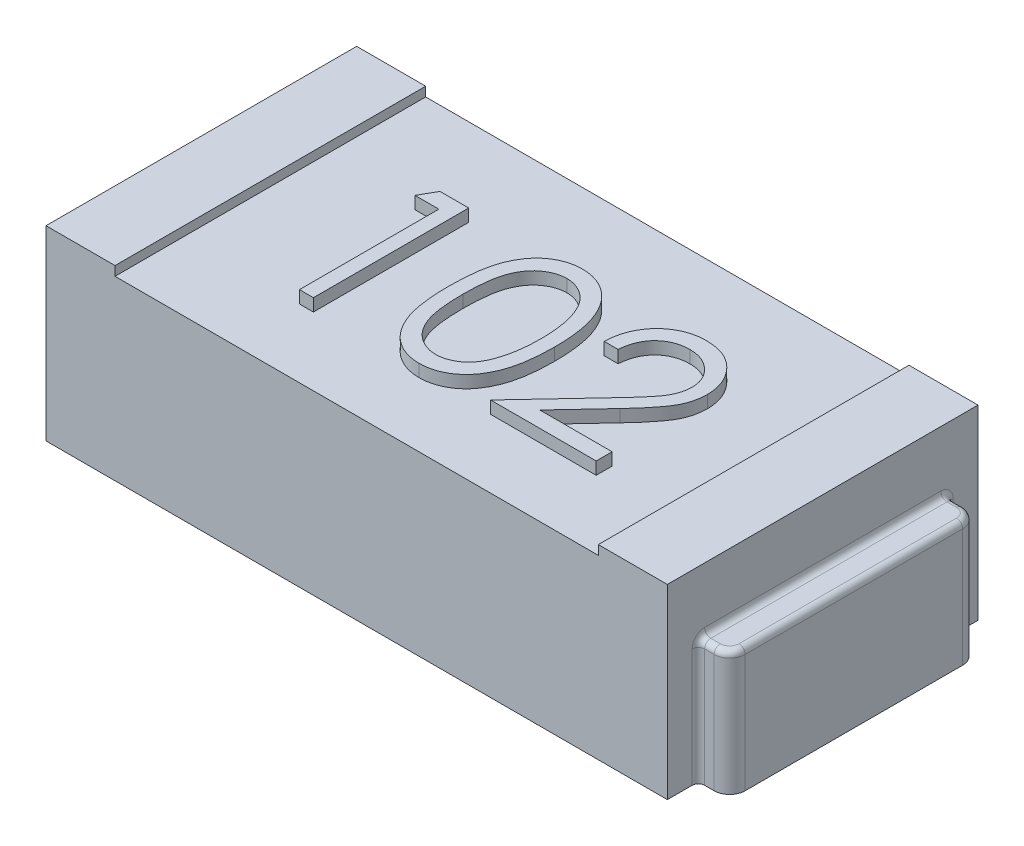
from build123d import *

# Parameters (mm, degrees)
ESQUISSE1_W             = 2
ESQUISSE1_H             = 1
BOSS_EXTRU_1_DEPTH      = 0.6
ESQUISSE2_W             = 1.555645222
ESQUISSE2_H             = 1
ENL_V_MAT_EXTRU_1_DEPTH = 0.03
BOSS_EXTRU_2_DEPTH      = 0.4
CONG_1_R                = 0.02
CONG_1_OF_SYM_TRIE2_R   = 0.02
BOSS_EXTRU_3_DEPTH      = 0.04


with BuildPart() as part:
    # Esquisse1 → Boss.-Extru.1 (new body)
    with BuildSketch(Plane(origin=(0, 0, 0), x_dir=(1, 0, 0), z_dir=(0, 1, 0))):
        Rectangle(ESQUISSE1_W, ESQUISSE1_H)
    extrude(amount=BOSS_EXTRU_1_DEPTH)

    # Esquisse2 → Enlèv. mat.-Extru.1 (cut)
    with BuildSketch(Plane(origin=(0, 0.6, 0), x_dir=(1, 0, 0), z_dir=(0, 1, 0))):
        Rectangle(ESQUISSE2_W, ESQUISSE2_H)
    extrude(amount=-ENL_V_MAT_EXTRU_1_DEPTH, mode=Mode.SUBTRACT)

    # Esquisse3 → Boss.-Extru.2 (add)
    with BuildSketch(Plane(origin=(0, 0, 0), x_dir=(1, 0, 0), z_dir=(0, 1, 0))):
        with BuildLine():
            Line((1, 0.4), (1.050552667, 0.4))
            ThreePointArc((1.050552667, 0.4), (1.085908006, 0.385355339), (1.100552667, 0.35))
            Line((1.100552667, 0.35), (1.100552667, -0.35))
            ThreePointArc((1.100552667, -0.35), (1.085908006, -0.385355339), (1.050552667, -0.4))
            Line((1.050552667, -0.4), (1, -0.4))
            Line((1, -0.4), (1, 0.4))
        make_face()
    boss_extru_2 = extrude(amount=BOSS_EXTRU_2_DEPTH)

    # Congé1
    cong_1_edges = [part.edges().sort_by_distance(p)[0] for p in [
        (1, 0.2, -0.4),
        (1, 0.2, 0.4),
        (1, 0.4, 0),
        (1.025276334, 0.4, 0.4),
        (1.085908006, 0.4, 0.385355339),
        (1.100552667, 0.4, 0),
        (1.085908006, 0.4, -0.385355339),
        (1.025276334, 0.4, -0.4),
    ]]
    fillet(cong_1_edges, radius=CONG_1_R)

    # Symétrie2: Boss.-Extru.2 across plane
    add(boss_extru_2.mirror(Plane(origin=(0, 0, 0), x_dir=(0, 0, 1), z_dir=(1, 0, 0))))

    # Congé1 of Symétrie2
    cong_1_of_sym_trie2_edges = [part.edges().sort_by_distance(p)[0] for p in [
        (-1, 0.2, -0.4),
        (-1, 0.2, 0.4),
        (-1, 0.4, 0),
        (-1.025276334, 0.4, 0.4),
        (-1.085908006, 0.4, 0.385355339),
        (-1.100552667, 0.4, 0),
        (-1.085908006, 0.4, -0.385355339),
        (-1.025276334, 0.4, -0.4),
    ]]
    fillet(cong_1_of_sym_trie2_edges, radius=CONG_1_OF_SYM_TRIE2_R)

    # Esquisse4 → Boss.-Extru.3 (add)
    # profile 1 of 3: a face of its own
    with BuildSketch(Plane(origin=(0, 0.57, 0), x_dir=(1, 0, 0), z_dir=(0, 1, 0))):
        with BuildLine():
            Line((0.275641026, 0.065854324), (0.230769231, 0.065854324))
            add(Edge.make_bspline(
                [(0.230769231, 0.065854324), (0.231061681, 0.071807307), (0.231636046, 0.08349881), (0.234325802, 0.100545082), (0.238174498, 0.116838625), (0.243616135, 0.132248612), (0.250374174, 0.146911299), (0.258478464, 0.160768444), (0.268077586, 0.173767185), (0.278964262, 0.18578702), (0.290788353, 0.196813816), (0.303546344, 0.206335994), (0.316952777, 0.214381375), (0.330966977, 0.221107267), (0.345747057, 0.226155816), (0.361158894, 0.229901765), (0.377270199, 0.232155528), (0.388247345, 0.232397784), (0.393830128, 0.23252099)],
                knots=[0, 0, 0, 0, 1.10065271, 2.161652631, 3.183658789, 4.190468796, 5.17591951, 6.163126047, 7.15150782, 8.156236427, 9.156009102, 10.134482811, 11.092018607, 12.041330605, 13.001268258, 13.972401359, 14.968799086, 16, 16, 16, 16], degree=3))
            add(Edge.make_bspline(
                [(0.393830128, 0.23252099), (0.39931271, 0.232392639), (0.410085788, 0.232140434), (0.425808933, 0.229974573), (0.440777118, 0.226582346), (0.454961085, 0.221823), (0.468247665, 0.215425225), (0.480736672, 0.207739862), (0.492576787, 0.198851315), (0.503234899, 0.188386485), (0.513021768, 0.177214715), (0.521464947, 0.165287872), (0.528695399, 0.152969403), (0.53472221, 0.140165374), (0.539158802, 0.126755227), (0.542527117, 0.112934198), (0.544431033, 0.098559225), (0.544723237, 0.088829717), (0.544871795, 0.08388317)],
                knots=[0, 0, 0, 0, 1.111607364, 2.184268762, 3.212621178, 4.221274766, 5.211760367, 6.196651075, 7.1921475, 8.207485113, 9.220403448, 10.201281604, 11.166441695, 12.114753415, 13.065576456, 14.026450734, 14.996634279, 16, 16, 16, 16], degree=3))
            add(Edge.make_bspline(
                [(0.544871795, 0.08388317), (0.5446299, 0.076919193), (0.544150356, 0.063113449), (0.540048302, 0.042825611), (0.533641657, 0.023169408), (0.525927749, 0.007349794), (0.518145972, -0.005397848), (0.511133471, -0.015893378), (0.502924212, -0.027194159), (0.493398712, -0.03926235), (0.482754016, -0.052192479), (0.470893707, -0.065976736), (0.45773321, -0.080472703), (0.448496281, -0.090373503), (0.443709936, -0.09550385)],
                knots=[0, 0, 0, 0, 1.184426356, 2.348067706, 3.509069118, 4.696110526, 5.333549288, 6.050745305, 6.844228056, 7.710549037, 8.667450064, 9.695053472, 10.805634456, 12, 12, 12, 12], degree=3))
            Line((0.443709936, -0.09550385), (0.318609776, -0.229017471))
            Line((0.318609776, -0.229017471), (0.551282051, -0.229017471))
            Line((0.551282051, -0.229017471), (0.551282051, -0.280299523))
            Line((0.551282051, -0.280299523), (0.211538462, -0.280299523))
            Line((0.211538462, -0.280299523), (0.405448718, -0.073368433))
            add(Edge.make_bspline(
                [(0.405448718, -0.073368433), (0.410169845, -0.068440103), (0.419238163, -0.058973791), (0.432064245, -0.045153368), (0.443584101, -0.032332005), (0.4538723, -0.020533927), (0.462705658, -0.00958656), (0.470544548, 0.000155541), (0.476825347, 0.009120462), (0.483641832, 0.019511978), (0.490243829, 0.032199452), (0.495917023, 0.047704265), (0.499376287, 0.063665301), (0.499791263, 0.074451306), (0.5, 0.079876759)],
                knots=[0, 0, 0, 0, 1.329631726, 2.553950428, 3.673215718, 4.687767853, 5.603093632, 6.413772471, 7.123043292, 7.734684054, 8.834405432, 9.900288307, 10.943827018, 12, 12, 12, 12], degree=3))
            add(Edge.make_bspline(
                [(0.5, 0.079876759), (0.49990918, 0.083288388), (0.49973019, 0.090012052), (0.498150519, 0.099870018), (0.495763304, 0.109379277), (0.492342553, 0.11856908), (0.487827304, 0.12734703), (0.482331107, 0.135723813), (0.47598967, 0.143822236), (0.468653774, 0.151415565), (0.460594985, 0.158370023), (0.452081521, 0.164530606), (0.443074363, 0.169679051), (0.433611489, 0.17389955), (0.423719279, 0.177210319), (0.413378601, 0.179504402), (0.402618027, 0.180944757), (0.395270385, 0.181139638), (0.391526442, 0.181238939)],
                knots=[0, 0, 0, 0, 0.991446411, 1.95395049, 2.89581595, 3.838931463, 4.798493298, 5.75982156, 6.748411868, 7.785213223, 8.824556874, 9.840280684, 10.836137867, 11.835679398, 12.848801643, 13.863922112, 14.911575587, 16, 16, 16, 16], degree=3))
            add(Edge.make_bspline(
                [(0.391526442, 0.181238939), (0.387616323, 0.181136791), (0.379937495, 0.180936191), (0.368663348, 0.179532953), (0.357908237, 0.177112119), (0.347645108, 0.173801165), (0.337856595, 0.169592801), (0.328590303, 0.164351123), (0.319867034, 0.158096338), (0.311670387, 0.15100483), (0.30411839, 0.143109459), (0.297483122, 0.134308036), (0.291685406, 0.124761262), (0.286626944, 0.114494898), (0.282518988, 0.103415786), (0.279379967, 0.091563257), (0.276896132, 0.078988774), (0.276066343, 0.07030519), (0.275641026, 0.065854324)],
                knots=[0, 0, 0, 0, 1.031018746, 2.02475058, 2.990194455, 3.934040569, 4.864654155, 5.795059489, 6.735614925, 7.690564532, 8.649604399, 9.611025574, 10.590972636, 11.591080095, 12.624614302, 13.701020113, 14.821632451, 16, 16, 16, 16], degree=3))
        make_face()
    # profile 2 of 3: a face of its own
    with BuildSketch(Plane(origin=(0, 0.57, 0), x_dir=(1, 0, 0), z_dir=(0, 1, 0))):
        with BuildLine():
            add(Edge.make_bspline(
                [(-0.173076923, -0.030499843), (-0.173030063, -0.022485931), (-0.172939038, -0.00691879), (-0.171926406, 0.01576473), (-0.170244214, 0.037044772), (-0.167938875, 0.056922352), (-0.16513345, 0.075402605), (-0.16138838, 0.092436141), (-0.157129408, 0.108101799), (-0.152193345, 0.122450663), (-0.14662366, 0.13567605), (-0.140561623, 0.148022507), (-0.133766653, 0.159471354), (-0.126627094, 0.170205324), (-0.11885394, 0.180048709), (-0.110668399, 0.189140518), (-0.101750988, 0.197270626), (-0.092404844, 0.20467724), (-0.082545349, 0.211170022), (-0.07245354, 0.216888984), (-0.062059953, 0.22177468), (-0.051336213, 0.225616171), (-0.040378704, 0.228789149), (-0.029149123, 0.230958998), (-0.017628929, 0.232324271), (-0.009853009, 0.232454795), (-0.005909455, 0.23252099)],
                knots=[0, 0, 0, 0, 1.646270934, 3.197905019, 4.663502075, 6.030701355, 7.308322542, 8.50163776, 9.611534131, 10.641858119, 11.616356847, 12.558055219, 13.465016945, 14.349605745, 15.204443733, 16.039544428, 16.859896111, 17.680448484, 18.487036065, 19.28249412, 20.06191084, 20.843045899, 21.620316918, 22.403196591, 23.190181807, 24, 24, 24, 24], degree=3))
            add(Edge.make_bspline(
                [(-0.005909455, 0.23252099), (-0.001932958, 0.232451302), (0.005975043, 0.232312715), (0.017666525, 0.230980723), (0.029087908, 0.228770563), (0.0401905, 0.225638995), (0.051065498, 0.221753898), (0.061627842, 0.21688431), (0.071943139, 0.211215901), (0.081847466, 0.204555347), (0.091449554, 0.197129307), (0.100513548, 0.18873464), (0.109040275, 0.179456109), (0.117136747, 0.169392986), (0.124573261, 0.158352259), (0.13165518, 0.146525958), (0.137994042, 0.133707263), (0.144098996, 0.120110053), (0.149368565, 0.105358102), (0.154120886, 0.089534565), (0.157960739, 0.072452538), (0.161159206, 0.054201646), (0.163637048, 0.034714862), (0.165441712, 0.01403396), (0.16639501, -0.007854667), (0.166574538, -0.022820074), (0.166666667, -0.030499843)],
                knots=[0, 0, 0, 0, 0.810914788, 1.612654377, 2.396697861, 3.181598691, 3.963628158, 4.749916497, 5.551656086, 6.361998678, 7.18212741, 8.025565596, 8.878627764, 9.750805457, 10.657531673, 11.591944965, 12.560506719, 13.57287815, 14.630710178, 15.753379473, 16.941251878, 18.199788006, 19.531962791, 20.947069417, 22.433333509, 24, 24, 24, 24], degree=3))
            add(Edge.make_bspline(
                [(0.166666667, -0.030499843), (0.166573583, -0.038146116), (0.166392214, -0.053044566), (0.165452398, -0.074834705), (0.163601165, -0.095405854), (0.161285453, -0.114807349), (0.158078172, -0.132958437), (0.154134577, -0.14992193), (0.14975596, -0.165771083), (0.144350989, -0.180376056), (0.138435173, -0.193940588), (0.131998717, -0.206607324), (0.125103027, -0.218488222), (0.117590349, -0.229488186), (0.109582719, -0.239685137), (0.100908749, -0.248899083), (0.091812951, -0.257352037), (0.082182606, -0.264873698), (0.072123813, -0.271457241), (0.061843945, -0.277344934), (0.051160605, -0.282092462), (0.040315897, -0.286168896), (0.029154702, -0.289283247), (0.017690932, -0.291436655), (0.005982898, -0.292946919), (-0.001931611, -0.29306213), (-0.005909455, -0.293120035)],
                knots=[0, 0, 0, 0, 1.561518951, 3.042555995, 4.452378317, 5.7783523, 7.031515105, 8.214008947, 9.334062868, 10.386615937, 11.391082383, 12.354592575, 13.286541444, 14.194233754, 15.072674879, 15.931287219, 16.775624067, 17.606195743, 18.42308326, 19.229000347, 20.022332153, 20.807536673, 21.593273796, 22.3848459, 23.188221202, 24, 24, 24, 24], degree=3))
            add(Edge.make_bspline(
                [(-0.005909455, -0.293120035), (-0.0098529, -0.293053413), (-0.017628604, -0.292922047), (-0.029150379, -0.291562943), (-0.040333585, -0.289377871), (-0.051233407, -0.286318356), (-0.061905766, -0.282573379), (-0.072205236, -0.277694282), (-0.082246333, -0.272075129), (-0.09200227, -0.265675783), (-0.101289721, -0.258344114), (-0.110160951, -0.25023493), (-0.118393096, -0.241145871), (-0.12605511, -0.231220454), (-0.133337123, -0.22054999), (-0.140035605, -0.208988794), (-0.146231441, -0.196582707), (-0.151894797, -0.183251577), (-0.156916034, -0.168800873), (-0.161351421, -0.153065276), (-0.164853444, -0.135905899), (-0.167851009, -0.117460561), (-0.170268778, -0.09765), (-0.171919396, -0.07646346), (-0.172939583, -0.053914145), (-0.173030308, -0.038447034), (-0.173076923, -0.030499843)],
                knots=[0, 0, 0, 0, 0.810891512, 1.598919785, 2.382837074, 3.152667961, 3.926044502, 4.706494248, 5.493654104, 6.291793342, 7.103789334, 7.925228297, 8.761435821, 9.622817696, 10.50288917, 11.416980706, 12.369136599, 13.353924996, 14.394355917, 15.514179734, 16.714354668, 17.994756427, 19.357759367, 20.818452758, 22.365282078, 24, 24, 24, 24], degree=3))
        make_face()
        with BuildLine():
            add(Edge.make_bspline(
                [(-0.128205128, -0.030299523), (-0.128188064, -0.036977908), (-0.128154947, -0.049939343), (-0.127289775, -0.068774095), (-0.126111171, -0.086341285), (-0.124590985, -0.102663218), (-0.122333421, -0.117684649), (-0.11980388, -0.131508889), (-0.116725582, -0.14406278), (-0.113083436, -0.155432467), (-0.108934994, -0.165810906), (-0.104405585, -0.175468222), (-0.099539767, -0.184518499), (-0.094094174, -0.192880443), (-0.088163451, -0.200581323), (-0.081881557, -0.207757442), (-0.075014045, -0.214157011), (-0.06551351, -0.221832276), (-0.052971157, -0.229763581), (-0.037168234, -0.236670165), (-0.020929884, -0.241010516), (-0.009908277, -0.241562481), (-0.004407051, -0.241837984)],
                knots=[0, 0, 0, 0, 1.459021318, 2.831673884, 4.118529203, 5.306027144, 6.411944654, 7.436330062, 8.375795394, 9.233974572, 10.042671642, 10.816086306, 11.563610507, 12.285937304, 12.993564865, 13.685989202, 14.367179055, 15.041617293, 16.353048772, 17.594441528, 18.799311195, 20, 20, 20, 20], degree=3))
            add(Edge.make_bspline(
                [(-0.004407051, -0.241837984), (0.001129759, -0.24160973), (0.012191948, -0.241153692), (0.028353919, -0.236753873), (0.044043957, -0.230115367), (0.056339949, -0.222265723), (0.065694598, -0.214790248), (0.072397025, -0.208416726), (0.078548746, -0.201280174), (0.084383328, -0.193580275), (0.089734625, -0.18516992), (0.094600787, -0.176089552), (0.099041266, -0.166313955), (0.101571129, -0.159489707), (0.102864583, -0.156000644)],
                knots=[0, 0, 0, 0, 1.353760809, 2.704726607, 4.075137775, 5.516104923, 6.260822281, 7.007110065, 7.778089737, 8.566572457, 9.372053459, 10.217411131, 11.088608312, 12, 12, 12, 12], degree=3))
            add(Edge.make_bspline(
                [(0.102864583, -0.156000644), (0.104371979, -0.151539253), (0.107432638, -0.142480715), (0.111377177, -0.128428765), (0.114483663, -0.113685513), (0.117278429, -0.098339068), (0.119186009, -0.082276253), (0.12072141, -0.06554677), (0.121625794, -0.048138004), (0.121737902, -0.036310148), (0.121794872, -0.030299523)],
                knots=[0, 0, 0, 0, 0.884706709, 1.796334032, 2.740027952, 3.714592787, 4.726048262, 5.777819803, 6.87074269, 8, 8, 8, 8], degree=3))
            add(Edge.make_bspline(
                [(0.121794872, -0.030299523), (0.121716273, -0.024289869), (0.121562518, -0.012533703), (0.120974805, 0.00468318), (0.119457152, 0.021035717), (0.117771564, 0.036594356), (0.115286246, 0.051272971), (0.11260656, 0.065194443), (0.109006386, 0.078186304), (0.105160704, 0.090451958), (0.100759219, 0.101852052), (0.095914114, 0.112439736), (0.090739577, 0.122266125), (0.085119257, 0.131304259), (0.079119874, 0.139594623), (0.072583081, 0.146970993), (0.065768171, 0.153661989), (0.056222858, 0.161299499), (0.043726531, 0.169086884), (0.028177153, 0.176253421), (0.011995633, 0.180368891), (0.001056568, 0.180949132), (-0.004407051, 0.181238939)],
                knots=[0, 0, 0, 0, 1.31362396, 2.569729283, 3.763502607, 4.902122613, 5.988968491, 7.01645872, 7.998833611, 8.933434873, 9.825090667, 10.667526885, 11.477055099, 12.250526234, 12.991942729, 13.710640831, 14.402115721, 15.076753259, 16.378508321, 17.609869233, 18.806226677, 20, 20, 20, 20], degree=3))
            add(Edge.make_bspline(
                [(-0.004407051, 0.181238939), (-0.009937136, 0.180948732), (-0.02100738, 0.18036779), (-0.037357087, 0.176268754), (-0.053029138, 0.169124045), (-0.06549242, 0.161273706), (-0.075044389, 0.153796804), (-0.081770488, 0.147313025), (-0.088077084, 0.140220703), (-0.093886756, 0.132449001), (-0.099328082, 0.124096805), (-0.104325369, 0.11509841), (-0.108827845, 0.105408216), (-0.112982779, 0.095034439), (-0.116636034, 0.083665733), (-0.119649458, 0.071127305), (-0.122433322, 0.057347035), (-0.124404075, 0.042244248), (-0.12615604, 0.025918226), (-0.127281947, 0.008307181), (-0.128157841, -0.01055916), (-0.12818905, -0.023587611), (-0.128205128, -0.030299523)],
                knots=[0, 0, 0, 0, 1.207732386, 2.417664972, 3.655092373, 4.956220595, 5.625982001, 6.301752483, 6.994047911, 7.697131622, 8.419323945, 9.170223765, 9.943494443, 10.752040957, 11.610060368, 12.549350801, 13.567764191, 14.679664412, 15.874934091, 17.154273443, 18.533957287, 20, 20, 20, 20], degree=3))
        make_face(mode=Mode.SUBTRACT)
    # profile 3 of 3: a face of its own
    with BuildSketch(Plane(origin=(0, 0.57, 0), x_dir=(1, 0, 0), z_dir=(0, 1, 0))):
        Polygon((-0.451422276, 0.219700477), (-0.358974359, 0.219700477), (-0.358974359, -0.280299523), (-0.403846154, -0.280299523), (-0.403846154, 0.168418426), (-0.480769231, 0.168418426), align=None)
    extrude(amount=BOSS_EXTRU_3_DEPTH)


solid = part.part
